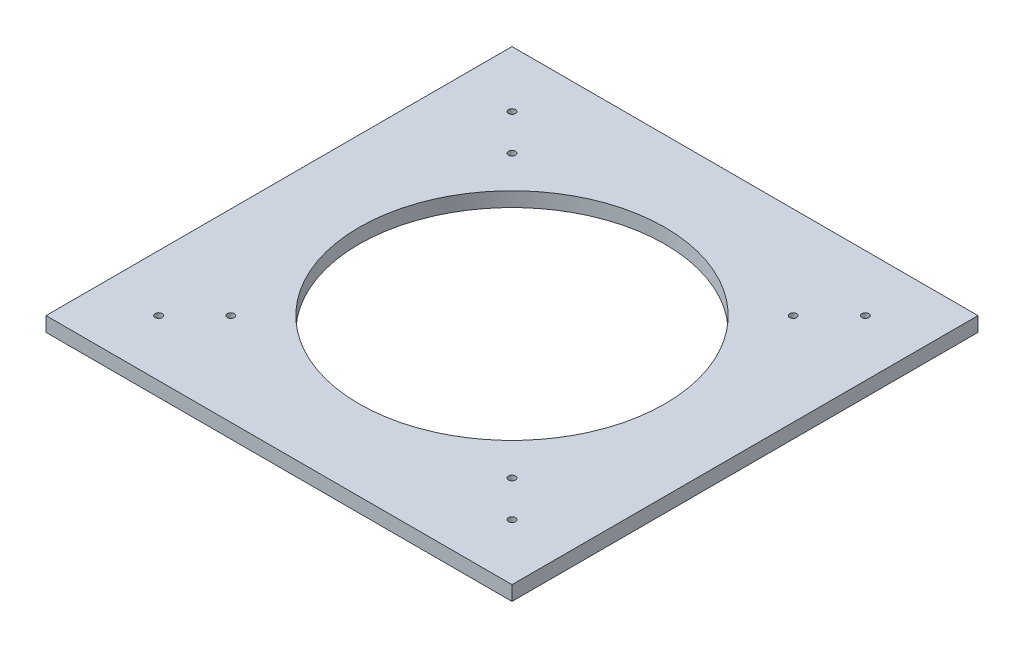
from build123d import *

# Parameters (mm, degrees)
SKETCH1_W           = 160
SKETCH1_H           = 160
SKETCH1_R           = 1.2
SKETCH1_R_2         = 52.5
BOSS_EXTRUDE1_DEPTH = 5


with BuildPart() as part:
    # Sketch1 → Boss-Extrude1 (new body)
    with BuildSketch(Plane(origin=(0, 0, 0), x_dir=(1, 0, 0), z_dir=(0, 1, 0))):
        Rectangle(SKETCH1_W, SKETCH1_H)
        with Locations(Location((-60.664206642, 60.664206642, 0), (0, 0, 270))):
            Circle(SKETCH1_R, mode=Mode.SUBTRACT)
        with Locations(Location((-48.279552135, 48.279552135, 0), (0, 0, 270))):
            Circle(SKETCH1_R, mode=Mode.SUBTRACT)
        with Locations(Location((48.279552135, 48.279552135, 0), (0, 0, 90))):
            Circle(SKETCH1_R, mode=Mode.SUBTRACT)
        with Locations(Location((60.664206642, 60.664206642, 0), (0, 0, 90))):
            Circle(SKETCH1_R, mode=Mode.SUBTRACT)
        with Locations(Location((60.664206642, -60.664206642, 0), (0, 0, 270))):
            Circle(SKETCH1_R, mode=Mode.SUBTRACT)
        with Locations(Location((48.279552135, -48.279552135, 0), (0, 0, 270))):
            Circle(SKETCH1_R, mode=Mode.SUBTRACT)
        with Locations(Location((-48.279552135, -48.279552135, 0), (0, 0, 90))):
            Circle(SKETCH1_R, mode=Mode.SUBTRACT)
        with Locations(Location((-60.664206642, -60.664206642, 0), (0, 0, 90))):
            Circle(SKETCH1_R, mode=Mode.SUBTRACT)
        with Locations(Location((0, 0, 0), (0, 0, 270))):
            Circle(SKETCH1_R_2, mode=Mode.SUBTRACT)
    extrude(amount=BOSS_EXTRUDE1_DEPTH)


solid = part.part
